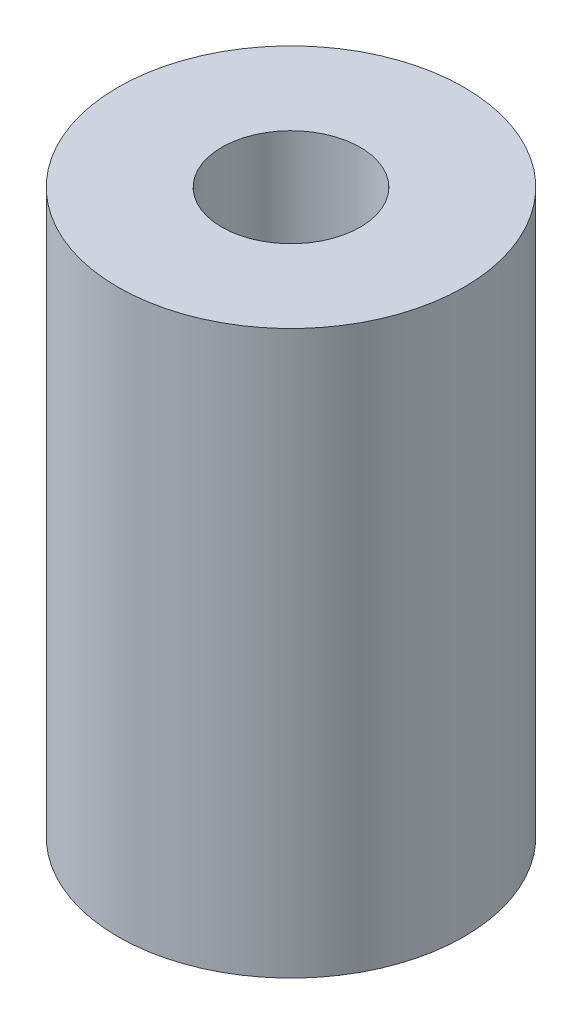
from build123d import *

# Parameters (mm, degrees)
SKETCH_1_R      = 10
SKETCH_1_R_2    = 2.5
EXTRUDE_1_DEPTH = 15
SKETCH_2_R      = 10
SKETCH_2_R_2    = 4
EXTRUDE_2_DEPTH = 17.5


with BuildPart() as part:
    # 草图1 → 凸台-拉伸1 (new body)
    with BuildSketch(Plane(origin=(0, 0, 0), x_dir=(1, 0, 0), z_dir=(0, 1, 0))):
        with Locations(Location((0, 0, 0), (0, 0, 270))):
            Circle(SKETCH_1_R)
        with Locations(Location((0, 0, 0), (0, 0, 270))):
            Circle(SKETCH_1_R_2, mode=Mode.SUBTRACT)
    extrude(amount=EXTRUDE_1_DEPTH)

    # 草图2 → 凸台-拉伸2 (add)
    with BuildSketch(Plane(origin=(0, 15, 0), x_dir=(1, 0, 0), z_dir=(0, 1, 0))):
        with Locations(Location((0, 0, 0), (0, 0, 270))):
            Circle(SKETCH_2_R)
        with Locations(Location((0, 0, 0), (0, 0, 270))):
            Circle(SKETCH_2_R_2, mode=Mode.SUBTRACT)
    extrude(amount=EXTRUDE_2_DEPTH)


solid = part.part
